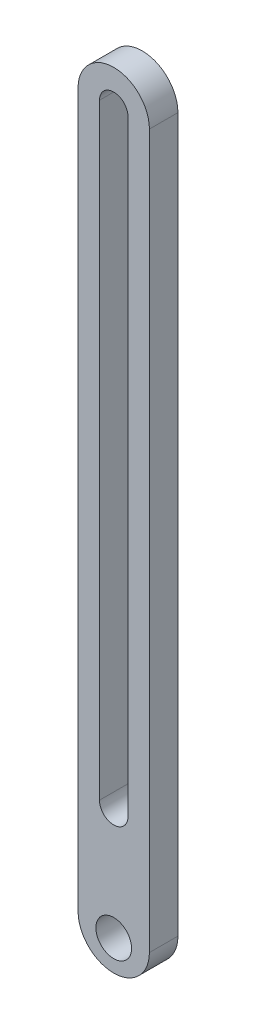
from build123d import *

# Parameters (mm, degrees)
BOSS_EXTRUDE1_DEPTH = 8
SKETCH3_R           = 5
CUT_EXTRUDE1_DEPTH  = 8


with BuildPart() as part:
    # Sketch2 → Boss-Extrude1 (new body)
    with BuildSketch(Plane.XY):
        with BuildLine():
            Line((10, 174.996075103), (10, -25.003924897))
            ThreePointArc((10, -25.003924897), (0, -35.003924897), (-10, -25.003924897))
            Line((-10, -25.003924897), (-10, 174.996075103))
            ThreePointArc((-10, 174.996075103), (0, 184.996075103), (10, 174.996075103))
        make_face()
        with BuildLine():
            Line((4, 174.996075103), (4, 4.996075103))
            ThreePointArc((4, 4.996075103), (0, 0.996075103), (-4, 4.996075103))
            Line((-4, 4.996075103), (-4, 174.996075103))
            ThreePointArc((-4, 174.996075103), (0, 178.996075103), (4, 174.996075103))
        make_face(mode=Mode.SUBTRACT)
    extrude(amount=BOSS_EXTRUDE1_DEPTH)

    # Sketch3 → Cut-Extrude1 (cut)
    with BuildSketch(Plane.XY.offset(8)):
        with Locations((0, -26.482483783)):
            Circle(SKETCH3_R)
    extrude(amount=-CUT_EXTRUDE1_DEPTH, mode=Mode.SUBTRACT)


solid = part.part
